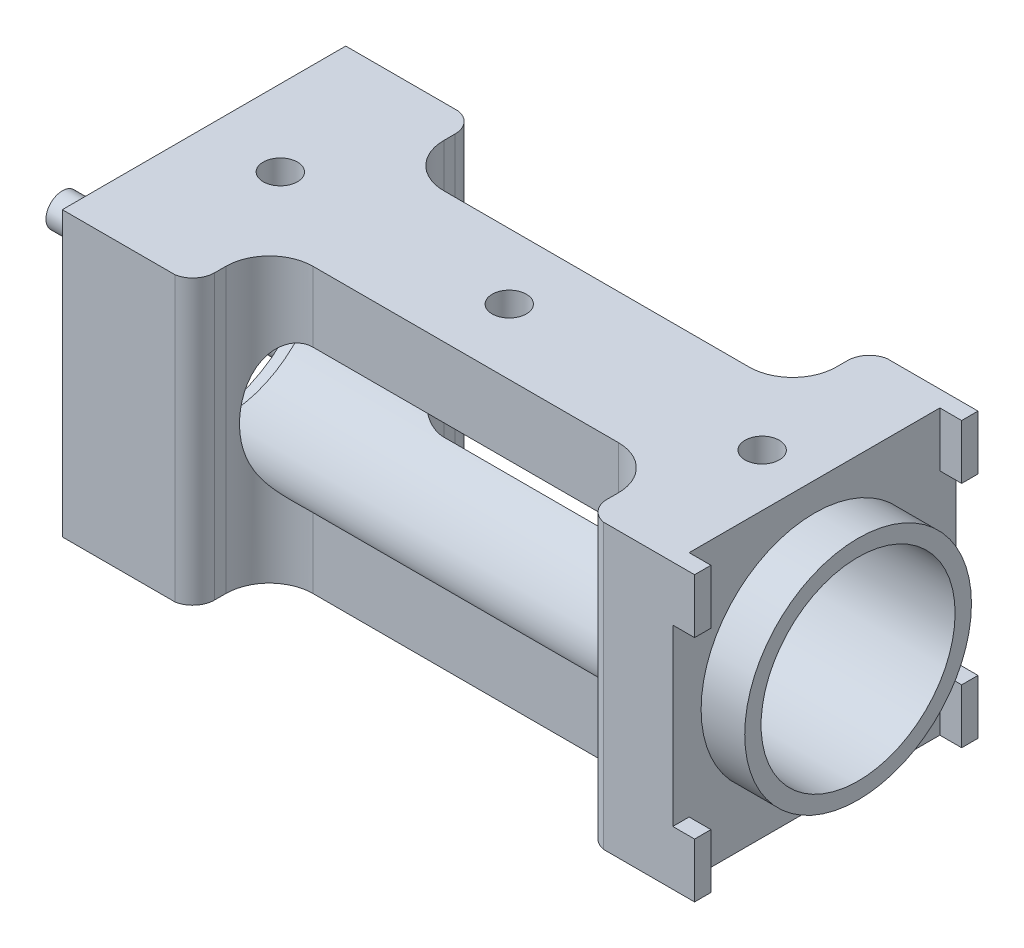
from build123d import *

# Parameters (mm, degrees)
SKETCH_2_W                  = 26
SKETCH_2_H                  = 26
SKETCH_2_R                  = 8.9
SKETCH_3_R                  = 1.5
EXTRUDE_725_DEPTH           = 3
SKETCH_4_R                  = 10.4
CUT_EXTRUDE_1_DEPTH         = 2
CUT_EXTRUDE_1112_DEPTH      = 63.753485959
CUT_EXTRUDE_1112_DEPTH_BACK = 63.753485959
CUT_EXTRUDE_START           = -4
SKETCH_6_R                  = 10.4
CUT_EXTRUDE_3_DEPTH         = 4
SKETCH_7_W                  = 1.5
SKETCH_7_H                  = 5
CUT_EXTRUDE_4_DEPTH         = 2
SKETCH_8_R                  = 1.57
CUT_EXTRUDE_1865_DEPTH      = 63.753486075
SKETCH_9_R                  = 1.5
CUT_EXTRUDE_2182_DEPTH      = 4


with BuildPart() as part:
    # Sweep 575: sweep along a path in 草图1
    with BuildLine(Plane.XY) as sweep_575_path:
        Line((0, 0), (60, 0))
    # 草图2 → Sweep 575 (sweep)
    with BuildSketch(Plane(origin=(0, 0, 0), x_dir=(0, 0, -1), z_dir=(1, 0, 0))):
        Rectangle(SKETCH_2_W, SKETCH_2_H)
        Circle(SKETCH_2_R, mode=Mode.SUBTRACT)
    sweep(path=sweep_575_path.line)

    # 草图3 → Extrude 725 (add)
    with BuildSketch(Plane(origin=(0, 0, 0), x_dir=(0, 0, -1), z_dir=(1, 0, 0))):
        with Locations((-10, 10)):
            Circle(SKETCH_3_R)
        with Locations((10, -10)):
            Circle(SKETCH_3_R)
    extrude(amount=-EXTRUDE_725_DEPTH)

    # 草图4 → 切除-拉伸1 (cut)
    with BuildSketch(Plane(origin=(0, 0, 0), x_dir=(0, 0, -1), z_dir=(1, 0, 0))):
        Circle(SKETCH_4_R)
    extrude(amount=CUT_EXTRUDE_1_DEPTH, mode=Mode.SUBTRACT)

    # 草图5 → Cut-Extrude 1112 (cut, two sides: drawn at the far end of the back side and taken through both)
    with BuildSketch(Plane(origin=(0, 0, 0), x_dir=(1, 0, 0), z_dir=(0, 1, 0)).offset(-CUT_EXTRUDE_1112_DEPTH_BACK)):
        with BuildLine():
            Line((12, -11.030498673), (12, -10))
            ThreePointArc((12, -10), (13.171572875, -7.171572875), (16, -6))
            Line((16, -6), (44, -6))
            ThreePointArc((44, -6), (46.828427125, -7.171572875), (48, -10))
            Line((48, -10), (48, -11.030498673))
            ThreePointArc((48, -11.030498673), (48.585786438, -12.444712235), (50, -13.030498673))
            Line((50, -13.030498673), (10, -13.030498673))
            ThreePointArc((10, -13.030498673), (11.414213562, -12.444712235), (12, -11.030498673))
        make_face()
        with BuildLine():
            Line((48, 10), (48, 11.030498673))
            ThreePointArc((48, 11.030498673), (48.585786438, 12.444712235), (50, 13.030498673))
            Line((50, 13.030498673), (10, 13.030498673))
            ThreePointArc((10, 13.030498673), (11.414213562, 12.444712235), (12, 11.030498673))
            Line((12, 11.030498673), (12, 10))
            ThreePointArc((12, 10), (13.171572875, 7.171572875), (16, 6))
            Line((16, 6), (44, 6))
            ThreePointArc((44, 6), (46.828427125, 7.171572875), (48, 10))
        make_face()
    extrude(amount=CUT_EXTRUDE_1112_DEPTH + CUT_EXTRUDE_1112_DEPTH_BACK, mode=Mode.SUBTRACT)

    # 草图6 → 切除-拉伸3 (cut)
    with BuildSketch(Plane(origin=(60, 0, 0), x_dir=(0, 0, -1), z_dir=(1, 0, 0)).offset(CUT_EXTRUDE_START)):
        Polygon((-13, 8), (-11.5, 8), (-11.5, 13), (11.5, 13), (11.5, 8), (13, 8), (13, -8), (11.5, -8), (11.5, -13), (-11.5, -13), (-11.5, -8), (-13, -8), align=None)
        Circle(SKETCH_6_R, mode=Mode.SUBTRACT)
    extrude(amount=CUT_EXTRUDE_3_DEPTH, mode=Mode.SUBTRACT)

    # 草图7 → 切除-拉伸4 (cut)
    with BuildSketch(Plane(origin=(60, 0, 0), x_dir=(0, 0, -1), z_dir=(1, 0, 0))):
        with Locations((-12.25, 10.5)):
            Rectangle(SKETCH_7_W, SKETCH_7_H)
        with Locations((12.25, 10.5)):
            Rectangle(SKETCH_7_W, SKETCH_7_H)
        with Locations((12.25, -10.5)):
            Rectangle(SKETCH_7_W, SKETCH_7_H)
        with Locations((-12.25, -10.5)):
            Rectangle(SKETCH_7_W, SKETCH_7_H)
    extrude(amount=-CUT_EXTRUDE_4_DEPTH, mode=Mode.SUBTRACT)

    # 草图8 → Cut-Extrude 1865 (cut, through all)
    with BuildSketch(Plane(origin=(0, 0, 0), x_dir=(1, 0, 0), z_dir=(0, 1, 0))):
        with Locations(Location((7, 0, 0), (0, 0, 90))):
            Circle(SKETCH_8_R)
        with Locations(Location((28, 0, 0), (0, 0, 90))):
            Circle(SKETCH_8_R)
        with Locations(Location((51.2, 0, 0), (0, 0, 90))):
            Circle(SKETCH_8_R)
    extrude(amount=CUT_EXTRUDE_1865_DEPTH, mode=Mode.SUBTRACT)

    # 草图9 → Cut-Extrude 2182 (cut)
    with BuildSketch(Plane(origin=(0, 0, 0), x_dir=(0, 0, -1), z_dir=(1, 0, 0))):
        with Locations((10, 10)):
            Circle(SKETCH_9_R)
        with Locations((-10, -10)):
            Circle(SKETCH_9_R)
    extrude(amount=CUT_EXTRUDE_2182_DEPTH, mode=Mode.SUBTRACT)


solid = part.part
